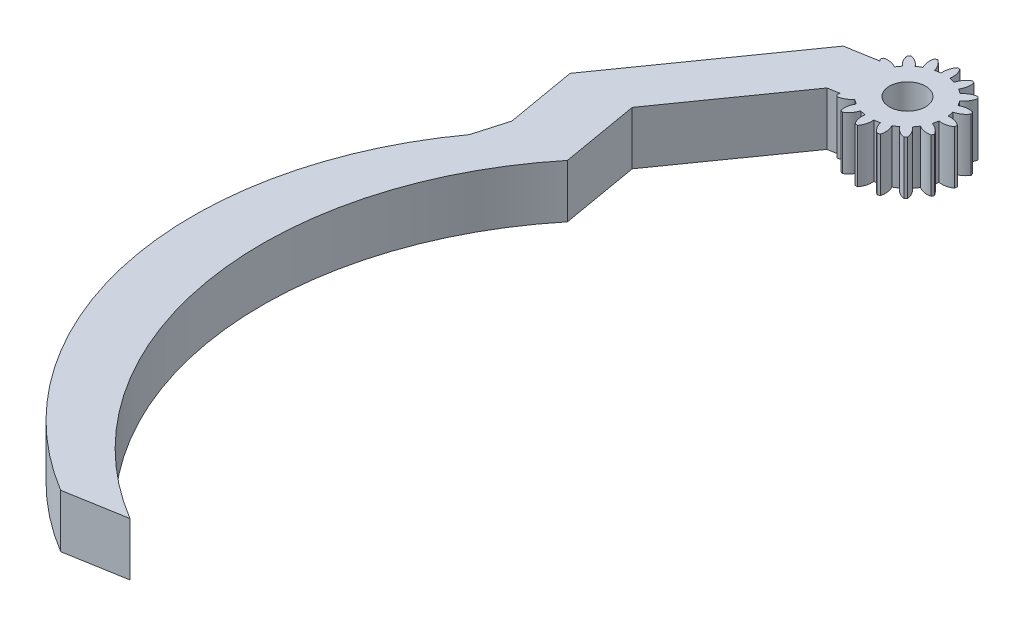
from build123d import *

# Parameters (mm, degrees)
SKETCH1_R           = 2.585044133
BOSS_EXTRUDE1_DEPTH = 7.62


with BuildPart() as part:
    # Sketch1 → Boss-Extrude1 (new body)
    with BuildSketch(Plane(origin=(0, 0, 0), x_dir=(1, 0, 0), z_dir=(0, 1, 0))):
        with BuildLine():
            Line((3.020276381, 31.156144465), (1.399779997, 30.876318364))
            Line((1.399779997, 30.876318364), (-10.128325028, 14.535897116))
            Line((-10.128325028, 14.535897116), (-8.192029601, 3.322648137))
            ThreePointArc((-8.192029601, 3.322648137), (-18.968565906, -37.532030496), (4.88487987, -72.406829787))
            Line((4.88487987, -72.406829787), (-3.568924444, -73.866626378))
            ThreePointArc((-3.568924444, -73.866626378), (-27.113440564, -40.443559332), (-18.408519275, -0.497721057))
            Line((-18.408519275, -0.497721057), (-17.051314308, 4.21102278))
            Line((-17.051314308, 4.21102278), (-18.796078997, 14.315101218))
            Line((-18.796078997, 14.315101218), (-2.622690692, 37.239942495))
            Line((-2.622690692, 37.239942495), (1.836758298, 38.009996803))
            ThreePointArc((1.836758298, 38.009996803), (1.726185886, 38.158240643), (1.62669315, 38.31413705))
            ThreePointArc((1.62669315, 38.31413705), (1.699886001, 38.484843232), (1.777492058, 38.653588881))
            ThreePointArc((1.777492058, 38.653588881), (2.738177728, 38.665878668), (3.634702712, 38.320464496))
            ThreePointArc((3.634702712, 38.320464496), (3.859539856, 38.666818829), (4.110435884, 38.994788717))
            ThreePointArc((4.110435884, 38.994788717), (3.484366991, 39.723558733), (3.173770753, 40.632733069))
            ThreePointArc((3.173770753, 40.632733069), (3.306718558, 40.762435326), (3.44299337, 40.888637424))
            ThreePointArc((3.44299337, 40.888637424), (4.335254295, 40.532353217), (5.031351097, 39.870146876))
            ThreePointArc((5.031351097, 39.870146876), (5.371617597, 40.104095105), (5.728923946, 40.311086019))
            ThreePointArc((5.728923946, 40.311086019), (5.42939992, 41.223967914), (5.490372369, 42.182795508))
            ThreePointArc((5.490372369, 42.182795508), (5.662835029, 42.251747846), (5.837031991, 42.316193269))
            ThreePointArc((5.837031991, 42.316193269), (6.525029535, 41.645576109), (6.914723727, 40.767392511))
            ThreePointArc((6.914723727, 40.767392511), (7.318617093, 40.853318139), (7.727937109, 40.907817588))
            ThreePointArc((7.727937109, 40.907817588), (7.800557769, 41.865833368), (8.223816402, 42.728341412))
            ThreePointArc((8.223816402, 42.728341412), (8.409538041, 42.726046463), (8.595137244, 42.718923979))
            ThreePointArc((8.595137244, 42.718923979), (8.974130017, 41.836069249), (8.998094191, 40.875603886))
            ThreePointArc((8.998094191, 40.875603886), (9.40412532, 40.800425515), (9.803143741, 40.694136452))
            ThreePointArc((9.803143741, 40.694136452), (10.236853249, 41.5514369), (10.957960776, 42.186316362))
            ThreePointArc((10.957960776, 42.186316362), (11.128666958, 42.113123511), (11.297412607, 42.035517454))
            ThreePointArc((11.297412607, 42.035517454), (11.309702393, 41.074831784), (10.964288222, 40.1783068))
            ThreePointArc((10.964288222, 40.1783068), (11.310642554, 39.953469656), (11.638612443, 39.702573628))
            ThreePointArc((11.638612443, 39.702573628), (12.367382459, 40.328642521), (13.276556795, 40.639238759))
            ThreePointArc((13.276556795, 40.639238759), (13.406259052, 40.506290954), (13.53246115, 40.370016142))
            ThreePointArc((13.53246115, 40.370016142), (13.176176943, 39.477755216), (12.513970602, 38.781658415))
            ThreePointArc((12.513970602, 38.781658415), (12.747918831, 38.441391914), (12.954909744, 38.084085566))
            ThreePointArc((12.954909744, 38.084085566), (13.867791639, 38.383609592), (14.826619234, 38.322637143))
            ThreePointArc((14.826619234, 38.322637143), (14.895571572, 38.150174482), (14.960016995, 37.975977521))
            ThreePointArc((14.960016995, 37.975977521), (14.289399835, 37.287979977), (13.411216236, 36.898285785))
            ThreePointArc((13.411216236, 36.898285785), (13.497141864, 36.494392418), (13.551641313, 36.085072403))
            ThreePointArc((13.551641313, 36.085072403), (14.509657094, 36.012451743), (15.372165138, 35.58919311))
            ThreePointArc((15.372165138, 35.58919311), (15.369870189, 35.403471471), (15.362747705, 35.217872267))
            ThreePointArc((15.362747705, 35.217872267), (14.479892975, 34.838879495), (13.519427611, 34.814915321))
            ThreePointArc((13.519427611, 34.814915321), (13.444249241, 34.408884192), (13.337960178, 34.009865771))
            ThreePointArc((13.337960178, 34.009865771), (14.195260626, 33.576156263), (14.830140088, 32.855048736))
            ThreePointArc((14.830140088, 32.855048736), (14.756947237, 32.684342554), (14.67934118, 32.515596905))
            ThreePointArc((14.67934118, 32.515596905), (13.718655509, 32.503307119), (12.822130526, 32.84872129))
            ThreePointArc((12.822130526, 32.84872129), (12.597293382, 32.502366958), (12.346397354, 32.174397069))
            ThreePointArc((12.346397354, 32.174397069), (12.972466247, 31.445627053), (13.283062484, 30.536452717))
            ThreePointArc((13.283062484, 30.536452717), (13.15011468, 30.40675046), (13.013839868, 30.280548362))
            ThreePointArc((13.013839868, 30.280548362), (12.121578942, 30.636832569), (11.42548214, 31.29903891))
            ThreePointArc((11.42548214, 31.29903891), (11.08521564, 31.065090681), (10.727909292, 30.858099767))
            ThreePointArc((10.727909292, 30.858099767), (11.027433317, 29.945217873), (10.966460868, 28.986390278))
            ThreePointArc((10.966460868, 28.986390278), (10.793998208, 28.91743794), (10.619801246, 28.852992517))
            ThreePointArc((10.619801246, 28.852992517), (9.931803703, 29.523609677), (9.54210951, 30.401793275))
            ThreePointArc((9.54210951, 30.401793275), (9.138216144, 30.315867647), (8.728896129, 30.261368198))
            ThreePointArc((8.728896129, 30.261368198), (8.656275469, 29.303352418), (8.233016836, 28.440844374))
            ThreePointArc((8.233016836, 28.440844374), (8.047295197, 28.443139323), (7.861695993, 28.450261807))
            ThreePointArc((7.861695993, 28.450261807), (7.482703221, 29.333116537), (7.458739046, 30.2935819))
            ThreePointArc((7.458739046, 30.2935819), (7.052707918, 30.368760271), (6.653689497, 30.475049334))
            ThreePointArc((6.653689497, 30.475049334), (6.219979988, 29.617748886), (5.498872462, 28.982869424))
            ThreePointArc((5.498872462, 28.982869424), (5.32816628, 29.056062275), (5.159420631, 29.133668332))
            ThreePointArc((5.159420631, 29.133668332), (5.147130844, 30.094354002), (5.492545016, 30.990878986))
            ThreePointArc((5.492545016, 30.990878986), (5.146190683, 31.21571613), (4.818220795, 31.466612158))
            ThreePointArc((4.818220795, 31.466612158), (4.089450779, 30.840543265), (3.180276443, 30.529947028))
            ThreePointArc((3.180276443, 30.529947028), (3.050574186, 30.662894832), (2.924372087, 30.799169644))
            ThreePointArc((2.924372087, 30.799169644), (2.965822028, 30.979403927), (3.020276381, 31.156144465))
        make_face()
        with Locations(Location((8.228416619, 35.584592893, 0), (0, 0, 90))):
            Circle(SKETCH1_R, mode=Mode.SUBTRACT)
    extrude(amount=BOSS_EXTRUDE1_DEPTH)


solid = part.part
